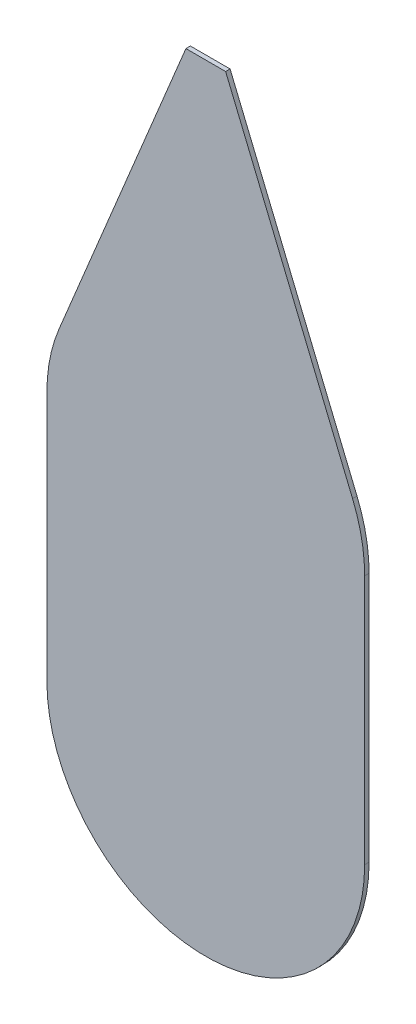
from build123d import *

# Parameters (mm, degrees)
BOSS_EXTRUDE2_DEPTH = 0.1778


with BuildPart() as part:
    # Sketch1 → Boss-Extrude2 (new body)
    with BuildSketch(Plane.XY):
        with BuildLine():
            Line((28.466511978, 5.161354222), (28.466511978, 15.161354222))
            ThreePointArc((28.466511978, 15.161354222), (28.344498508, 16.400177767), (27.983147009, 17.591394018))
            Line((27.983147009, 17.591394018), (22.910261978, 29.838421861))
            Line((22.910261978, 29.838421861), (21.322761978, 29.838421861))
            Line((21.322761978, 29.838421861), (16.249876946, 17.591394018))
            ThreePointArc((16.249876946, 17.591394018), (15.888525447, 16.400177767), (15.766511978, 15.161354222))
            Line((15.766511978, 15.161354222), (15.766511978, 5.161354222))
            ThreePointArc((15.766511978, 5.161354222), (22.116511978, -1.188645778), (28.466511978, 5.161354222))
        make_face()
    extrude(amount=-BOSS_EXTRUDE2_DEPTH)


solid = part.part
